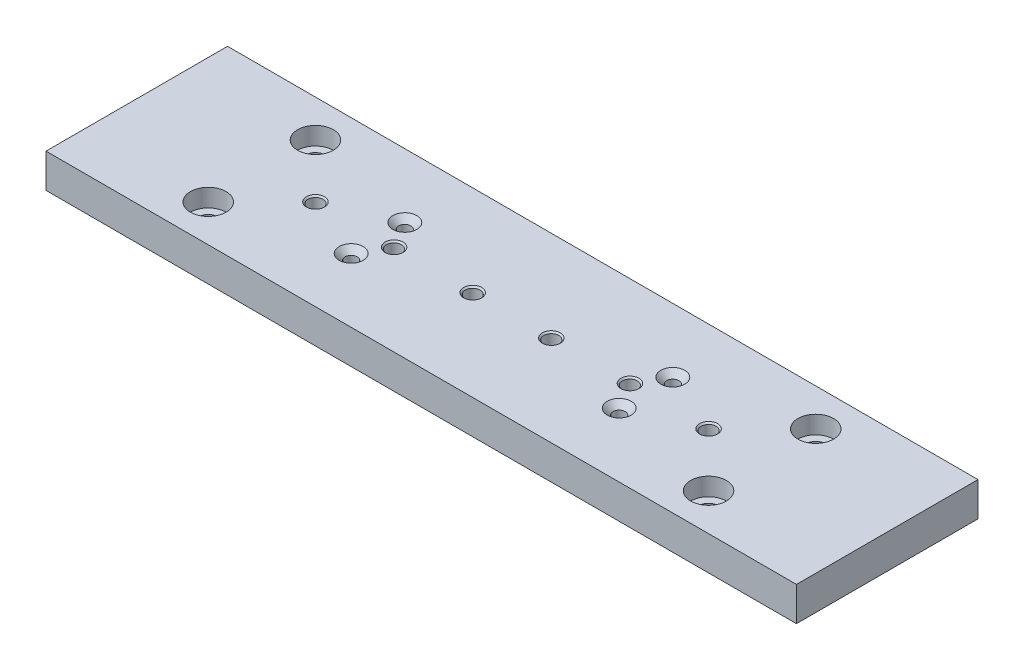
from build123d import *

# Parameters (mm, degrees)
SKETCH1_W                       = 210
SKETCH1_H                       = 50.8
BOSS_EXTRUDE1_DEPTH             = 9.525
CSK_FOR_M3_SFHCS1_D             = 3.4
CSK_FOR_M3_SFHCS1_CSINK_D       = 6.72
CSK_FOR_M3_SFHCS1_CSINK_ANGLE   = 90
CBORE_FOR_M5_SHCS1_D            = 5.5
CBORE_FOR_M5_SHCS1_CBORE_D      = 10
CBORE_FOR_M5_SHCS1_CBORE_DEPTH  = 5
M5X0_8_TAPPED_HOLE1_D           = 4.2
M5X0_8_TAPPED_HOLE1_CSINK_D     = 5.05
M5X0_8_TAPPED_HOLE1_CSINK_ANGLE = 90


with BuildPart() as part:
    # Sketch1 → Boss-Extrude1 (new body)
    with BuildSketch(Plane(origin=(0, 0, 0), x_dir=(1, 0, 0), z_dir=(0, 1, 0))):
        Rectangle(SKETCH1_W, SKETCH1_H)
    extrude(amount=BOSS_EXTRUDE1_DEPTH)

    # CSK for M3 SFHCS1 (through all)
    with Locations(Plane(origin=(0, 9.525, 0), x_dir=(1, 0, 0), z_dir=(0, 1, 0))):
        with Locations((-37.5, 7.5), (-37.5, -7.5), (37.5, -7.5), (37.5, 7.5)):
            CounterSinkHole(CSK_FOR_M3_SFHCS1_D / 2, CSK_FOR_M3_SFHCS1_CSINK_D / 2, counter_sink_angle=CSK_FOR_M3_SFHCS1_CSINK_ANGLE)

    # CBORE for M5 SHCS1 (through all)
    with Locations(Plane(origin=(0, 9.525, 0), x_dir=(1, 0, 0), z_dir=(0, 1, 0))):
        with Locations((-70, -15), (-70, 15)):
            cbore_for_m5_shcs1 = CounterBoreHole(CBORE_FOR_M5_SHCS1_D / 2, CBORE_FOR_M5_SHCS1_CBORE_D / 2, CBORE_FOR_M5_SHCS1_CBORE_DEPTH)

    # Mirror1: CBORE for M5 SHCS1 across plane
    add(cbore_for_m5_shcs1.mirror(Plane(origin=(0, 0, 0), x_dir=(0, 0, 1), z_dir=(1, 0, 0))), mode=Mode.SUBTRACT)

    # M5x0.8 Tapped Hole1 (through all)
    with Locations(Plane(origin=(0, 9.525, 0), x_dir=(1, 0, 0), z_dir=(0, 1, 0))):
        with Locations((-55, 0), (-33, 0), (-11, 0), (11, 0), (33, 0), (55, 0)):
            CounterSinkHole(M5X0_8_TAPPED_HOLE1_D / 2, M5X0_8_TAPPED_HOLE1_CSINK_D / 2, counter_sink_angle=M5X0_8_TAPPED_HOLE1_CSINK_ANGLE)


solid = part.part
